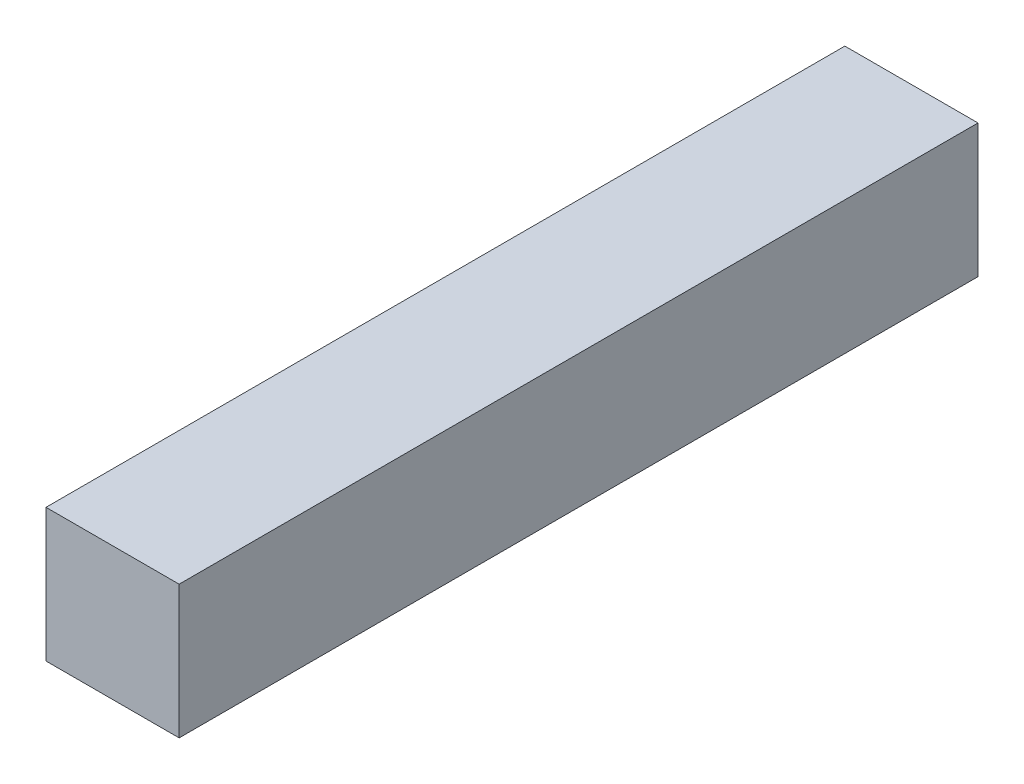
from build123d import *

# Parameters (mm, degrees)
SKETCH1_W           = 25.4
SKETCH1_H           = 25.4
BOSS_EXTRUDE1_DEPTH = 152.4


with BuildPart() as part:
    # Sketch1 → Boss-Extrude1 (new body)
    with BuildSketch(Plane.XY):
        Rectangle(SKETCH1_W, SKETCH1_H)
    extrude(amount=-BOSS_EXTRUDE1_DEPTH)


solid = part.part
